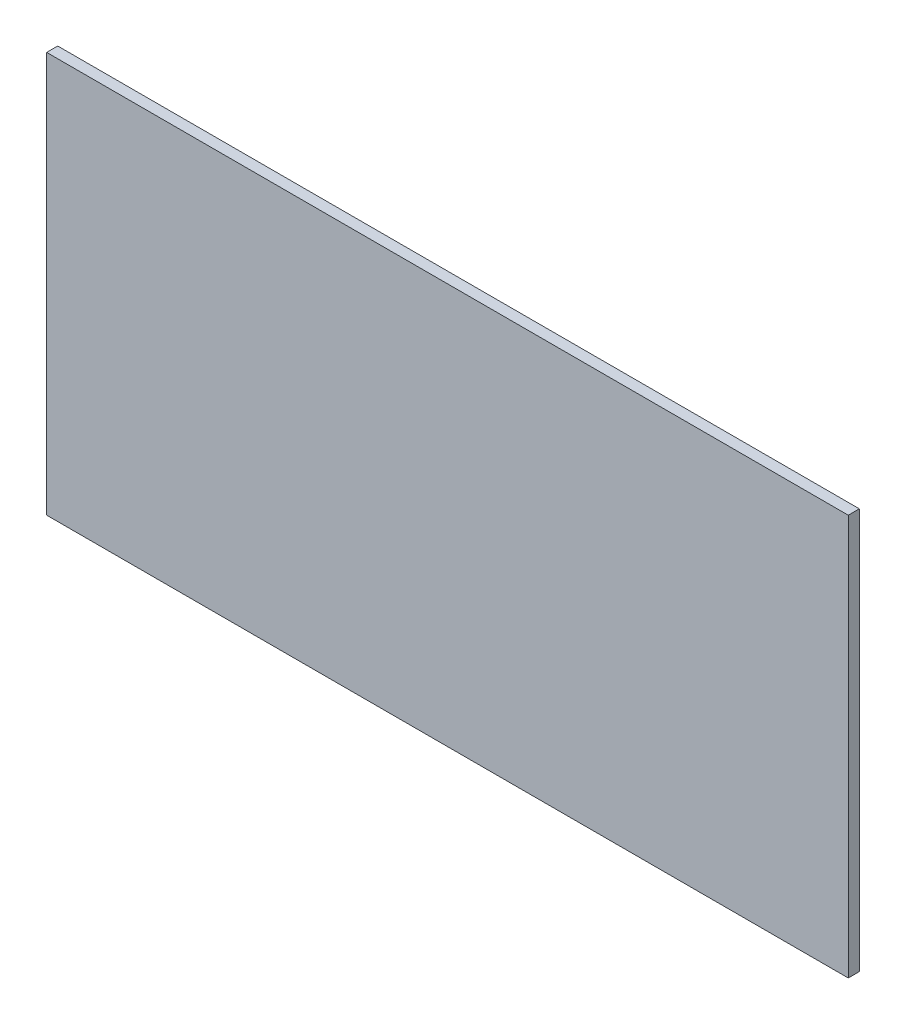
from build123d import *

# Parameters (mm, degrees)
SKETCH1_W           = 920
SKETCH1_H           = 460
BOSS_EXTRUDE1_DEPTH = 12.7


with BuildPart() as part:
    # Sketch1 → Boss-Extrude1 (new body)
    with BuildSketch(Plane.XY):
        Rectangle(SKETCH1_W, SKETCH1_H)
    extrude(amount=BOSS_EXTRUDE1_DEPTH)


solid = part.part
